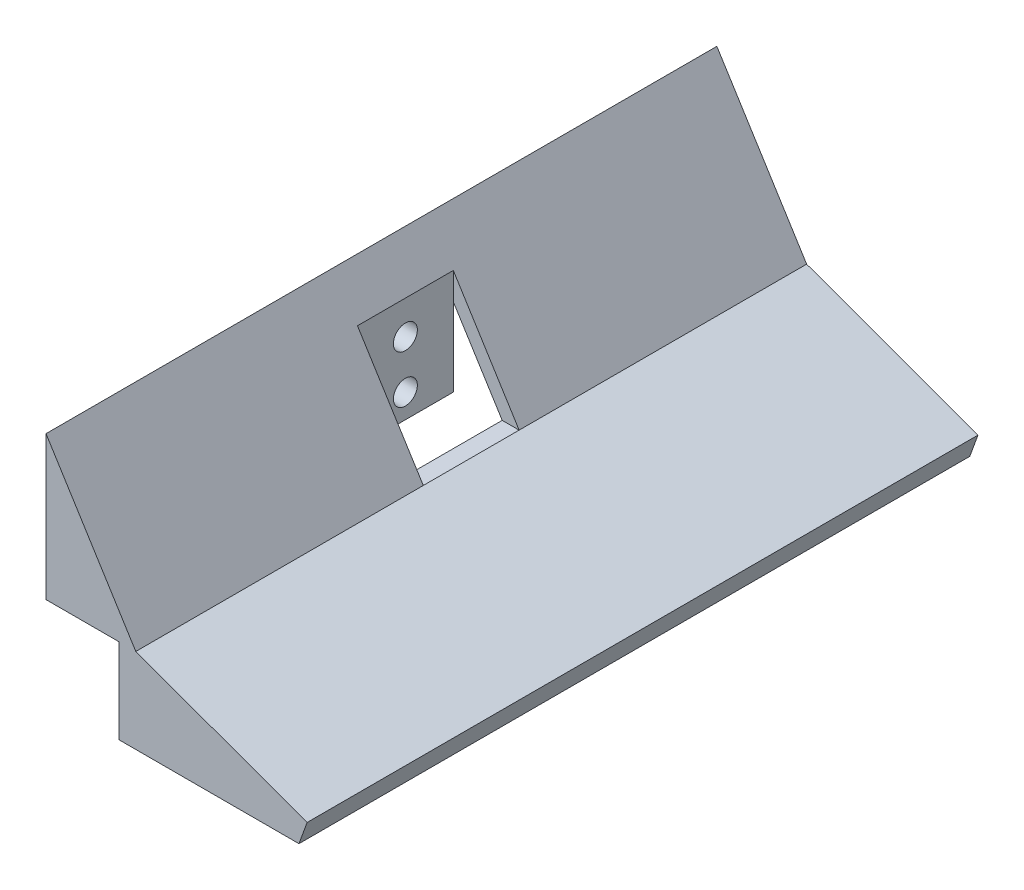
from build123d import *

# Parameters (mm, degrees)
EXTRUDE_1_DEPTH      = 5
EXTRUDE_2_DEPTH      = 135
EXTRUDE_2_DEPTH_BACK = 5
SKETCH_3_W           = 20
SKETCH_3_H           = 35.370571237
CUT_EXTRUDE_1_DEPTH  = 135
SKETCH_4_W           = 20
SKETCH_4_H           = 30
EXTRUDE_3_DEPTH      = 5
CUT_EXTRUDE_2_DEPTH  = 78
SKETCH_6_R           = 2.5
CUT_EXTRUDE_3_DEPTH  = 78
EXTRUDE_4_DEPTH      = 5
EXTRUDE_5_DEPTH      = 140
EXTRUDE_6_DEPTH      = 5
EXTRUDE_7_DEPTH      = 5


with BuildPart() as part:
    # 스케치1 → 보스-돌출1 (new body)
    with BuildSketch(Plane.XY):
        Polygon((-19.597361035, 21.927954703), (-19.597361035, -8.072045297), (-4.397361035, -8.072045297), align=None)
    extrude(amount=EXTRUDE_1_DEPTH)

    # 스케치2 → 보스-돌출2 (add, two sides: drawn at the far end of the back side and taken through both)
    with BuildSketch(Plane.XY.offset(5).offset(-EXTRUDE_2_DEPTH_BACK)):
        Polygon((-19.597361035, 21.927954703), (-0.860303912, -8.072045297), (-4.397361035, -8.072045297), (-19.597361035, 16.264754072), align=None)
    extrude(amount=EXTRUDE_2_DEPTH + EXTRUDE_2_DEPTH_BACK)

    # 스케치3 → 컷-돌출1 (cut)
    with BuildSketch(Plane(origin=(-4.245672665, -2.651713709, 0), x_dir=(0, 0, -1), z_dir=(0.8481627225827804, 0.5297357794419456, 0))):
        with Locations((-70, 11.294611466)):
            Rectangle(SKETCH_3_W, SKETCH_3_H)
    extrude(amount=-CUT_EXTRUDE_1_DEPTH, mode=Mode.SUBTRACT)


with BuildPart() as cut_extrude_1_piece_1:
    # of the separate pieces the step leaves, piece 1, a body of its own (cut_extrude_1_pieces)
    add(part.part.solids().sort_by_distance((-19.597361035, 21.927954703, 0))[0])



with BuildPart() as cut_extrude_1_piece_2:
    # of the separate pieces the step leaves, piece 2, a body of its own (cut_extrude_1_pieces)
    add(part.part.solids().sort_by_distance((-19.597361035, 16.264754072, 80))[0])


with BuildPart() as cut_extrude_1_piece_1_1:
    add(cut_extrude_1_piece_1.part)

    add(cut_extrude_1_piece_2.part)  # 보스-돌출3 merges 컷-돌출1 piece 2
    # 스케치4 → 보스-돌출3 (add)
    with BuildSketch(Plane.ZY.offset(19.597361035)):
        with Locations((70, 6.927954703)):
            Rectangle(SKETCH_4_W, SKETCH_4_H)
    extrude(amount=-EXTRUDE_3_DEPTH)

    # 스케치5 → 컷-돌출2 (cut)
    with BuildSketch(Plane.XY.offset(80)):
        Polygon((-19.597361035, 21.927954703), (-14.597361035, 21.927954703), (-14.597361035, 13.922428594), align=None)
    extrude(amount=-CUT_EXTRUDE_2_DEPTH, mode=Mode.SUBTRACT)

    # 스케치6 → 컷-돌출3 (cut)
    with BuildSketch(Plane.ZY.offset(19.597361035)):
        with Locations((70, -3.072045297)):
            Circle(SKETCH_6_R)
        with Locations((70, 6.927954703)):
            Circle(SKETCH_6_R)
    extrude(amount=-CUT_EXTRUDE_3_DEPTH, mode=Mode.SUBTRACT)

    # 스케치7 → 보스-돌출4 (add)
    with BuildSketch(Plane.XY.offset(140)):
        Polygon((-0.860303912, -8.072045297), (-19.597361035, 21.927954703), (-19.597361035, -8.072045297), align=None)
    extrude(amount=-EXTRUDE_4_DEPTH)

    # 스케치8 → 보스-돌출5 (add)
    with BuildSketch(Plane.XY.offset(140)):
        Polygon((34.900444513, -21.087893279), (-0.860303912, -8.072045297), (-4.397361035, -8.072045297), (-4.397361035, -12.10555065), (33.190343796, -25.786356383), align=None)
    extrude(amount=-EXTRUDE_5_DEPTH)

    # 스케치9 → 보스-돌출6 (add)
    with BuildSketch(Plane.XY.offset(140)):
        Polygon((33.190343796, -25.786356383), (-4.397361035, -25.786356383), (-4.397361035, -8.072045297), align=None)
    extrude(amount=-EXTRUDE_6_DEPTH)

    # 스케치10 → 보스-돌출7 (add)
    with BuildSketch(Plane(origin=(0, 0, 0), x_dir=(-1, 0, 0), z_dir=(0, 0, -1))):
        Polygon((-33.190343796, -25.786356383), (4.397361035, -25.786356383), (4.397361035, -10.088797974), align=None)
    extrude(amount=-EXTRUDE_7_DEPTH)


solid = cut_extrude_1_piece_1_1.part
